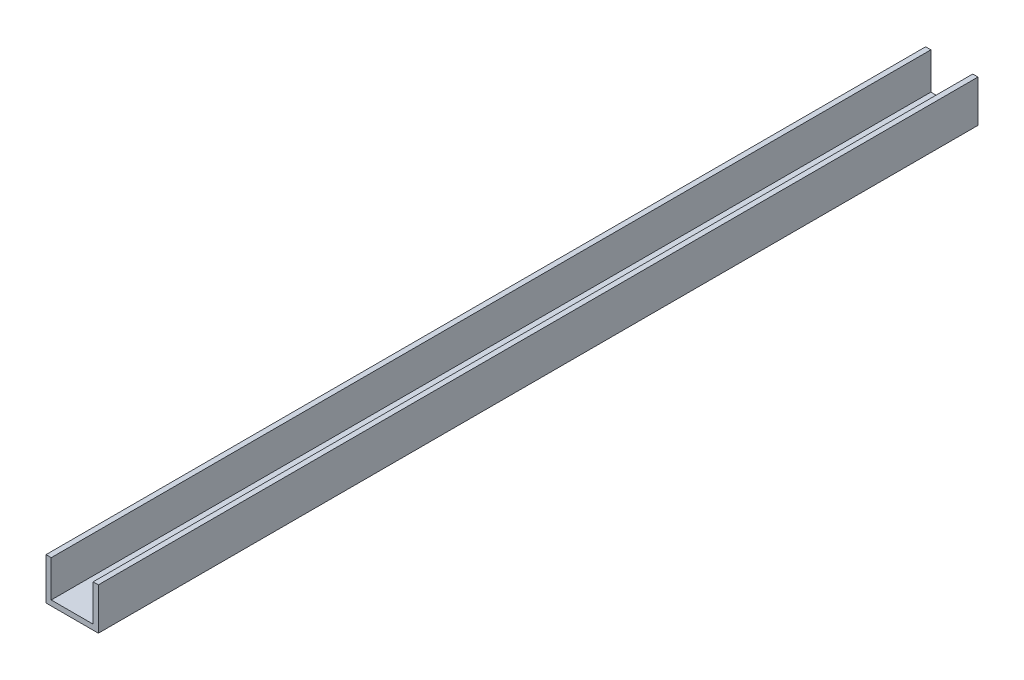
from build123d import *

# Parameters (mm, degrees)
BOSS_EXTRUDE1_DEPTH = 266.7


with BuildPart() as part:
    # Sketch1 → Boss-Extrude1 (new body)
    with BuildSketch(Plane.XY):
        Polygon((0, 0), (0, 12.7), (1.5875, 12.7), (1.5875, 1.5875), (14.2875, 1.5875), (14.2875, 12.7), (15.875, 12.7), (15.875, 0), align=None)
    extrude(amount=BOSS_EXTRUDE1_DEPTH)


solid = part.part
